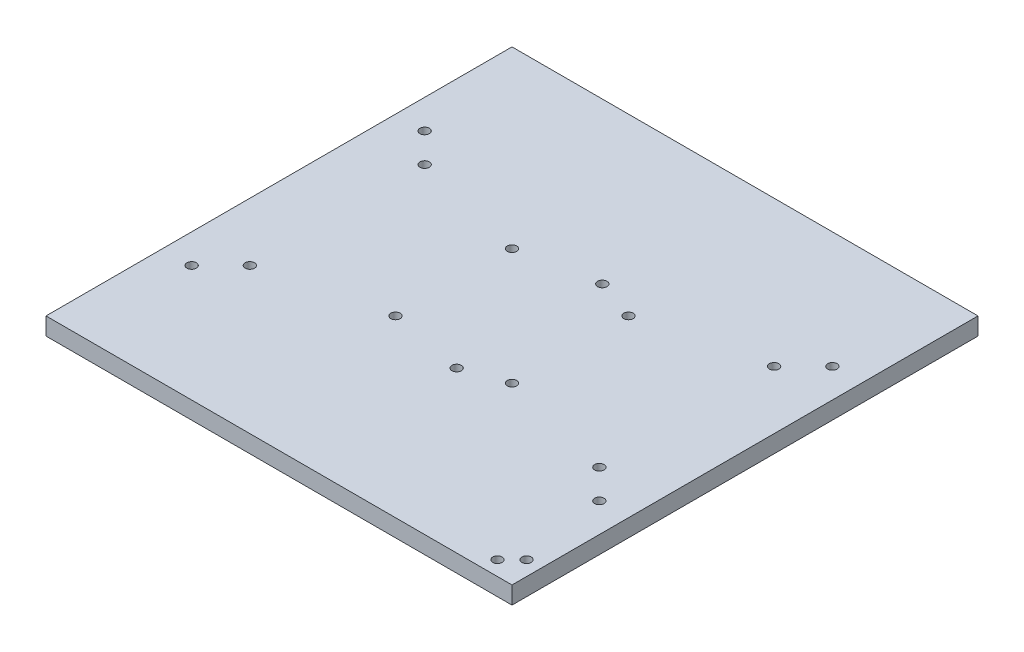
from build123d import *

# Parameters (mm, degrees)
CROQUIS1_W              = 160
CROQUIS1_H              = 160
CROQUIS1_R              = 1.61925
SALIENTE_EXTRUIR1_DEPTH = 6
CROQUIS5_R              = 1.61925
ESPACIO_EXTERNO_DEPTH   = 10
CROQUIS6_R              = 1.61925
ESPACIO_CENTRO_DEPTH    = 10
CROQUIS7_R              = 1.61925
CORTAR_EXTRUIR1_DEPTH   = 10
CROQUIS8_R              = 1.61925
CORTAR_EXTRUIR2_DEPTH   = 13


with BuildPart() as part:
    # Croquis1 → Saliente-Extruir1 (new body)
    with BuildSketch(Plane(origin=(0, 0, 0), x_dir=(1, 0, 0), z_dir=(0, 1, 0))):
        Rectangle(CROQUIS1_W, CROQUIS1_H)
        with Locations(Location((-60, 30, 0), (0, 0, 270))):
            Circle(CROQUIS1_R, mode=Mode.SUBTRACT)
        with Locations(Location((-60, -30, 0), (0, 0, 270))):
            Circle(CROQUIS1_R, mode=Mode.SUBTRACT)
        with Locations(Location((60, -30, 0), (0, 0, 270))):
            Circle(CROQUIS1_R, mode=Mode.SUBTRACT)
        with Locations(Location((60, 30, 0), (0, 0, 270))):
            Circle(CROQUIS1_R, mode=Mode.SUBTRACT)
    extrude(amount=SALIENTE_EXTRUIR1_DEPTH)

    # Croquis5 → Espacio_externo (cut)
    with BuildSketch(Plane(origin=(0, 6, 0), x_dir=(1, 0, 0), z_dir=(0, 1, 0))):
        with Locations(Location((-70, 40, 0), (0, 0, 270))):
            Circle(CROQUIS5_R)
        with Locations(Location((70, 40, 0), (0, 0, 270))):
            Circle(CROQUIS5_R)
        with Locations(Location((70, -40, 0), (0, 0, 270))):
            Circle(CROQUIS5_R)
        with Locations(Location((-70, -40, 0), (0, 0, 270))):
            Circle(CROQUIS5_R)
    extrude(amount=-ESPACIO_EXTERNO_DEPTH, mode=Mode.SUBTRACT)

    # Croquis6 → Espacio_Centro (cut)
    with BuildSketch(Plane(origin=(0, 6, 0), x_dir=(1, 0, 0), z_dir=(0, 1, 0))):
        with Locations(Location((-20, 20, 0), (0, 0, 270))):
            Circle(CROQUIS6_R)
        with Locations(Location((20, 20, 0), (0, 0, 270))):
            Circle(CROQUIS6_R)
        with Locations(Location((20, -20, 0), (0, 0, 270))):
            Circle(CROQUIS6_R)
        with Locations(Location((-20, -20, 0), (0, 0, 270))):
            Circle(CROQUIS6_R)
    extrude(amount=-ESPACIO_CENTRO_DEPTH, mode=Mode.SUBTRACT)

    # Croquis7 → Cortar-Extruir1 (cut)
    with BuildSketch(Plane(origin=(0, 6, 0), x_dir=(1, 0, 0), z_dir=(0, 1, 0))):
        with Locations(Location((6, 25, 0), (0, 0, 270))):
            Circle(CROQUIS7_R)
        with Locations(Location((6, -25, 0), (0, 0, 270))):
            Circle(CROQUIS7_R)
    extrude(amount=-CORTAR_EXTRUIR1_DEPTH, mode=Mode.SUBTRACT)

    # Croquis8 → Cortar-Extruir2 (cut)
    with BuildSketch(Plane(origin=(0, 6, 0), x_dir=(1, 0, 0), z_dir=(0, 1, 0))):
        with Locations(Location((70, -75, 0), (0, 0, 270))):
            Circle(CROQUIS8_R)
        with Locations(Location((75, -70, 0), (0, 0, 270))):
            Circle(CROQUIS8_R)
    extrude(amount=-CORTAR_EXTRUIR2_DEPTH, mode=Mode.SUBTRACT)


solid = part.part
